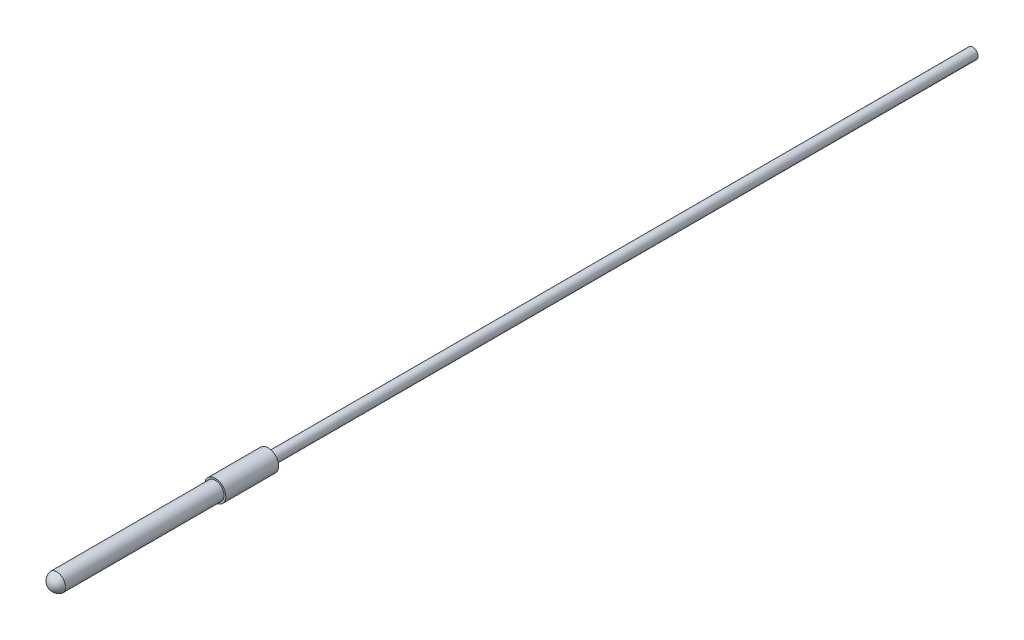
from build123d import *

# Parameters (mm, degrees)
ESQUISSE1_R        = 2.5
BOSS_EXTRU_1_DEPTH = 45
D_ME1_FACE_RADIUS  = 2.5
D_ME1_HEIGHT       = 2
ESQUISSE2_R        = 3
BOSS_EXTRU_2_DEPTH = 15
ESQUISSE3_R        = 1.5
BOSS_EXTRU_3_DEPTH = 200


with BuildPart() as part:
    # Esquisse1 → Boss.-Extru.1 (new body)
    with BuildSketch(Plane.XY):
        with Locations(Location((0, 0, 0), (0, 0, 180))):
            Circle(ESQUISSE1_R)
    extrude(amount=BOSS_EXTRU_1_DEPTH)

    # Dôme1: a dome of height H over a round flat face of radius A is a cap of a sphere of radius (A * A + H * H) / (2 * H)
    d_me1_r = (D_ME1_FACE_RADIUS * D_ME1_FACE_RADIUS + D_ME1_HEIGHT * D_ME1_HEIGHT) / (2 * D_ME1_HEIGHT)
    d_me1_base = Plane((0, 0, 45), z_dir=(0, 0, 1))
    with Locations(d_me1_base.offset(D_ME1_HEIGHT - d_me1_r)):
        d_me1_ball = Sphere(d_me1_r, mode=Mode.PRIVATE)
    add(split(d_me1_ball, bisect_by=d_me1_base, keep=Keep.TOP, mode=Mode.PRIVATE))

    # Esquisse2 → Boss.-Extru.2 (add)
    with BuildSketch(Plane(origin=(0, 0, 0), x_dir=(-1, 0, 0), z_dir=(0, 0, -1))):
        with Locations(Location((0, 0, 0), (0, 0, 180))):
            Circle(ESQUISSE2_R)
    extrude(amount=BOSS_EXTRU_2_DEPTH)

    # Esquisse3 → Boss.-Extru.3 (add)
    with BuildSketch(Plane(origin=(0, 0, -15), x_dir=(-1, 0, 0), z_dir=(0, 0, -1))):
        Circle(ESQUISSE3_R)
    extrude(amount=BOSS_EXTRU_3_DEPTH)


solid = part.part
